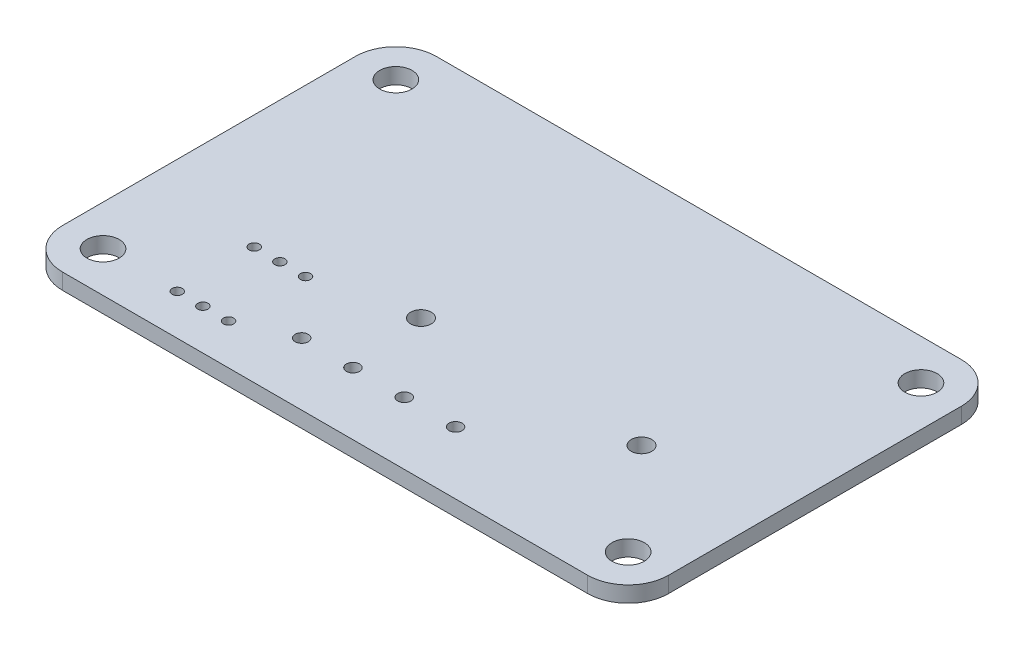
from build123d import *

# Parameters (mm, degrees)
SKETCH1_W            = 60
SKETCH1_H            = 37
BOSS_EXTRUDE1_DEPTH  = 1.5748
FILLET1_R            = 4
SKETCH2_R            = 1.6
CUT_EXTRUDE1_DEPTH   = 36.280731215
SKETCH3_R            = 1.016
CUT_EXTRUDE2_DEPTH   = 36.280731215
SKETCH4_R            = 0.6477
CUT_EXTRUDE3_DEPTH   = 36.280731215
LPATTERN1_COUNT      = 4
LPATTERN1_PITCH      = 5.08
SKETCH5_R            = 0.508
CUT_EXTRUDE4_DEPTH   = 36.280731215
LPATTERN2_COUNT      = 3
LPATTERN2_PITCH      = 2.54
LPATTERN2_COUNT_DIR2 = 2
LPATTERN2_PITCH_DIR2 = 7.62


with BuildPart() as part:
    # Sketch1 → Boss-Extrude1 (new body)
    with BuildSketch(Plane(origin=(0, 0, 0), x_dir=(1, 0, 0), z_dir=(0, 1, 0))):
        Rectangle(SKETCH1_W, SKETCH1_H)
    extrude(amount=BOSS_EXTRUDE1_DEPTH)

    # Fillet1
    fillet1_edges = [part.edges().sort_by_distance(p)[0] for p in [
        (30, 0.7874, 18.5),
        (-30, 0.7874, 18.5),
        (-30, 0.7874, -18.5),
        (30, 0.7874, -18.5),
    ]]
    fillet(fillet1_edges, radius=FILLET1_R)

    # Sketch2 → Cut-Extrude1 (cut, through all)
    with BuildSketch(Plane(origin=(0, 1.5748, 0), x_dir=(1, 0, 0), z_dir=(0, 1, 0))):
        with Locations(Location((-26, 14.5, 0), (0, 0, 270))):
            Circle(SKETCH2_R)
        with Locations(Location((-26, -14.5, 0), (0, 0, 270))):
            Circle(SKETCH2_R)
        with Locations(Location((26, -14.5, 0), (0, 0, 270))):
            Circle(SKETCH2_R)
        with Locations(Location((26, 14.5, 0), (0, 0, 270))):
            Circle(SKETCH2_R)
    extrude(amount=-CUT_EXTRUDE1_DEPTH, mode=Mode.SUBTRACT)

    # Sketch3 → Cut-Extrude2 (cut, through all)
    with BuildSketch(Plane(origin=(0, 1.5748, 0), x_dir=(-1, 0, 0), z_dir=(0, 1, 0))):
        with Locations(Location((4.318, 4.699, 0), (0, 0, 90))):
            Circle(SKETCH3_R)
        with Locations(Location((-17.526, 4.699, 0), (0, 0, 90))):
            Circle(SKETCH3_R)
    extrude(amount=-CUT_EXTRUDE2_DEPTH, mode=Mode.SUBTRACT)

    # Sketch4 → Cut-Extrude3 (cut, through all)
    with BuildSketch(Plane(origin=(0, 1.5748, 0), x_dir=(1, 0, 0), z_dir=(0, 1, 0))):
        with Locations(Location((6.731, -12.319, 0), (0, 0, 270))):
            Circle(SKETCH4_R)
    cut_extrude3 = extrude(amount=-CUT_EXTRUDE3_DEPTH, mode=Mode.SUBTRACT)

    # LPattern1: Cut-Extrude3 ×4
    with Locations(*[(-i * LPATTERN1_PITCH, 0, 0) for i in range(1, LPATTERN1_COUNT)]):
        add(cut_extrude3, mode=Mode.SUBTRACT)

    # Sketch5 → Cut-Extrude4 (cut, through all)
    with BuildSketch(Plane(origin=(0, 1.5748, 0), x_dir=(1, 0, 0), z_dir=(0, 1, 0))):
        with Locations(Location((-13.589, -14.478, 0), (0, 0, 270))):
            Circle(SKETCH5_R)
    cut_extrude4 = extrude(amount=-CUT_EXTRUDE4_DEPTH, mode=Mode.SUBTRACT)

    # LPattern2: Cut-Extrude4 3 × 2
    with Locations(*[(-i * LPATTERN2_PITCH, 0, -j * LPATTERN2_PITCH_DIR2) for i in range(LPATTERN2_COUNT) for j in range(LPATTERN2_COUNT_DIR2) if (i, j) != (0, 0)]):
        add(cut_extrude4, mode=Mode.SUBTRACT)


solid = part.part
